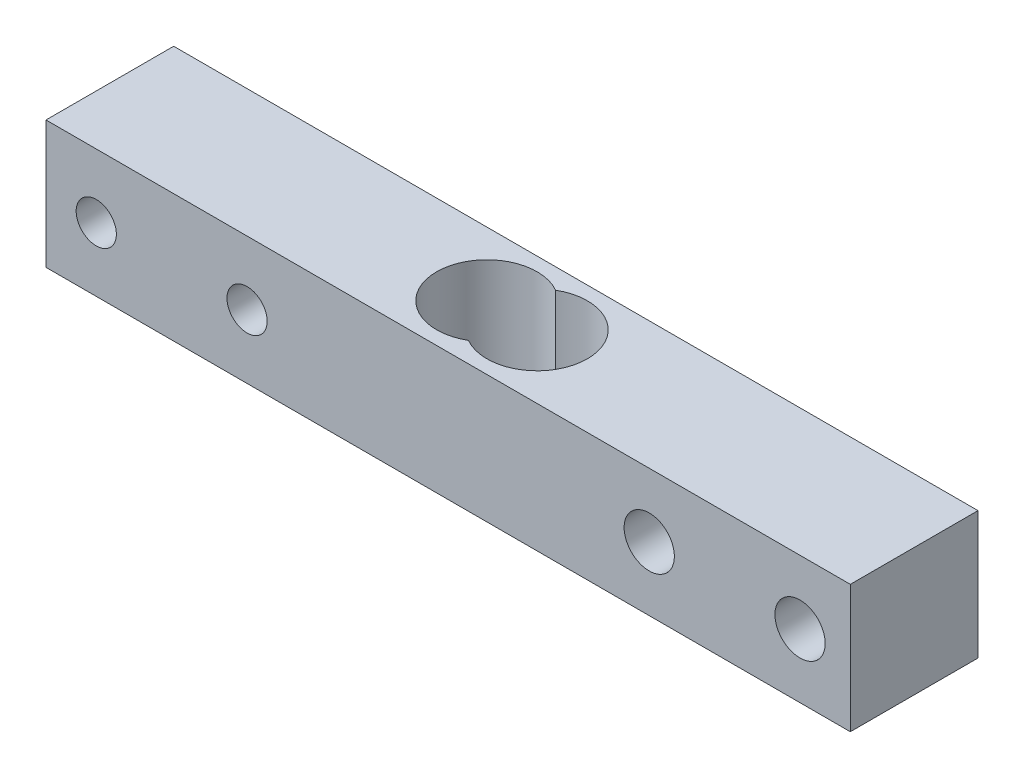
from build123d import *

# Parameters (mm, degrees)
IZIM1_W                     = 80
IZIM1_H                     = 12.7
Y_KSEKLIK_EKSTR_ZYON1_DEPTH = 12.7
IZIM2_R                     = 2.5
IZIM2_R_2                   = 2
KES_EKSTR_ZYON1_DEPTH       = 12.7
KES_EKSTR_ZYON2_DEPTH       = 19.7


with BuildPart() as part:
    # Çizim1 → Yükseklik-Ekstrüzyon1 (new body)
    with BuildSketch(Plane.XY):
        Rectangle(IZIM1_W, IZIM1_H)
    extrude(amount=Y_KSEKLIK_EKSTR_ZYON1_DEPTH)

    # Çizim2 → Kes-Ekstrüzyon1 (cut)
    with BuildSketch(Plane.XY.offset(12.7)):
        with Locations((35, 0)):
            Circle(IZIM2_R)
        with Locations((20, 0)):
            Circle(IZIM2_R)
        with Locations((-35, 0)):
            Circle(IZIM2_R_2)
        with Locations((-20, 0)):
            Circle(IZIM2_R_2)
    extrude(amount=-KES_EKSTR_ZYON1_DEPTH, mode=Mode.SUBTRACT)

    # Çizim3 → Kes-Ekstrüzyon2 (cut)
    with BuildSketch(Plane(origin=(0, 6.35, 0), x_dir=(1, 0, 0), z_dir=(0, 1, 0))):
        with BuildLine():
            ThreePointArc((0, -2.019872981), (-7.5, -6.35), (0, -10.680127019))
            ThreePointArc((0, -10.680127019), (7.5, -6.35), (0, -2.019872981))
        make_face()
    extrude(amount=-KES_EKSTR_ZYON2_DEPTH, mode=Mode.SUBTRACT)


solid = part.part
